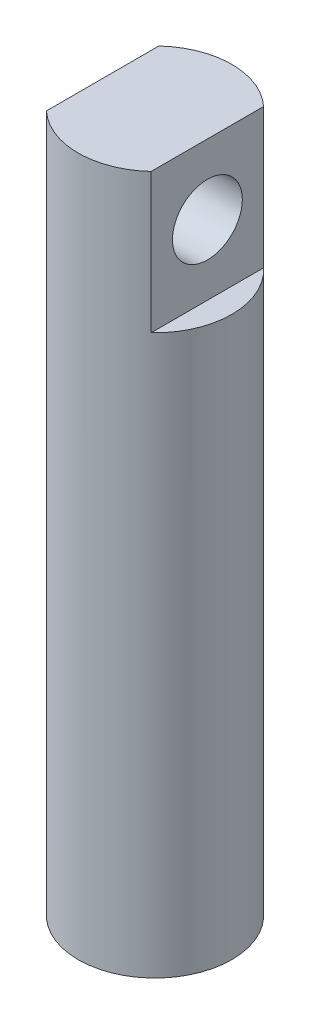
from build123d import *

# Parameters (mm, degrees)
SKETCH1_R           = 4.4
BOSS_EXTRUDE1_DEPTH = 40
SKETCH2_W           = 2.8
SKETCH2_H           = 6.437390776
CUT_EXTRUDE1_DEPTH  = 8
SKETCH3_R           = 2
CUT_EXTRUDE2_DEPTH  = 41.916011536


with BuildPart() as part:
    # Sketch1 → Boss-Extrude1 (new body)
    with BuildSketch(Plane(origin=(0, 0, 0), x_dir=(1, 0, 0), z_dir=(0, 1, 0))):
        with Locations(Location((0, 0, 0), (0, 0, 270))):
            Circle(SKETCH1_R)
    extrude(amount=BOSS_EXTRUDE1_DEPTH)

    # Sketch2 → Cut-Extrude1 (cut)
    with BuildSketch(Plane(origin=(0, 40, 0), x_dir=(1, 0, 0), z_dir=(0, 1, 0))):
        with Locations((-4.4, 0)):
            Rectangle(SKETCH2_W, SKETCH2_H)
        with Locations((4.4, 0)):
            Rectangle(SKETCH2_W, SKETCH2_H)
    extrude(amount=-CUT_EXTRUDE1_DEPTH, mode=Mode.SUBTRACT)

    # Sketch3 → Cut-Extrude2 (cut, through all)
    with BuildSketch(Plane(origin=(3, 0, 0), x_dir=(0, 0, -1), z_dir=(1, 0, 0))):
        with Locations((0, 36)):
            Circle(SKETCH3_R)
    extrude(amount=-CUT_EXTRUDE2_DEPTH, mode=Mode.SUBTRACT)


solid = part.part
